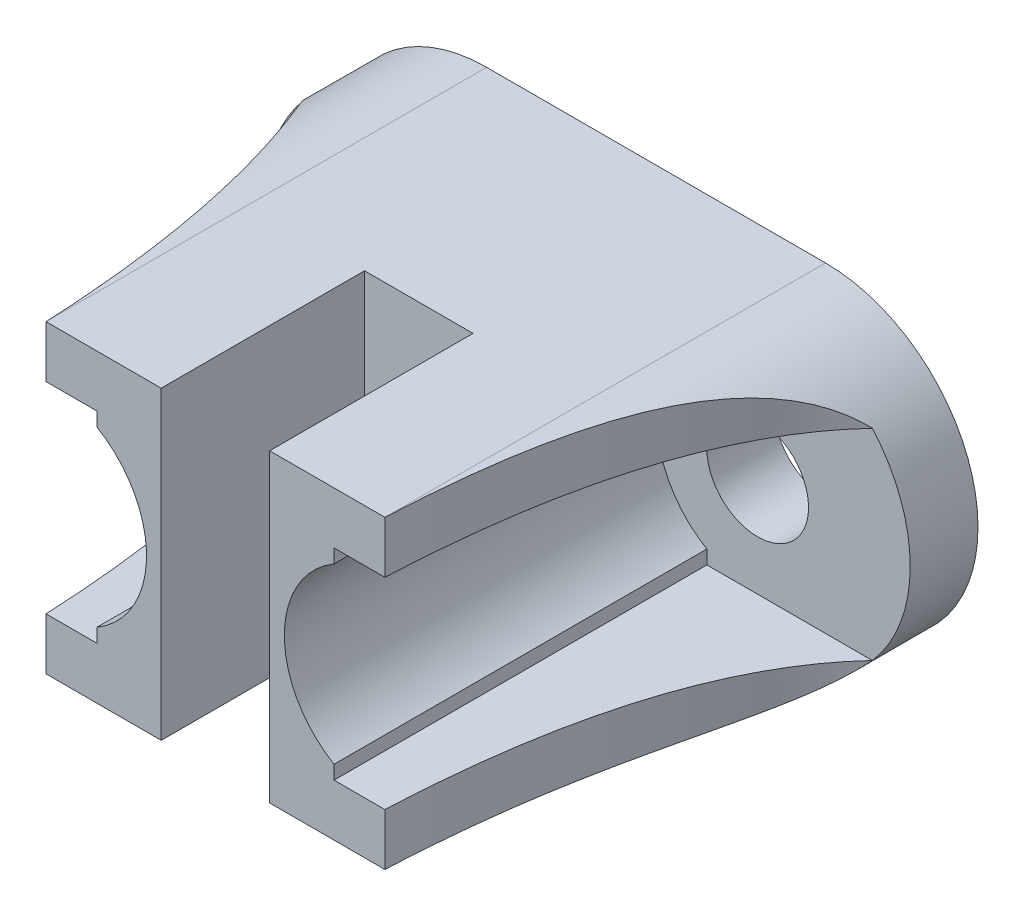
from build123d import *

# Parameters (mm, degrees)
SKETCH1_R               = 1.5
BOSS_EXTRUDE1_DEPTH     = 2
SKETCH2_W               = 7
SKETCH2_H               = 9
BOSS_EXTRUDE2_DEPTH     = 5
SKETCH2_3_W             = 1.9
SKETCH2_3_H             = 9
BOSS_EXTRUDE3_DEPTH     = 11
BOSS_EXTRUDE4_DEPTH     = 11
CUT_EXTRUDE1_DEPTH      = 17.718253497
CUT_EXTRUDE1_DEPTH_BACK = 17.718253497
SKETCH5_R               = 2.966905055
CUT_EXTRUDE2_DEPTH      = 11


with BuildPart() as part:
    # Sketch1 → Boss-Extrude1 (new body)
    with BuildSketch(Plane.XY):
        with BuildLine():
            Line((-5, 4.5), (5, 4.5))
            ThreePointArc((5, 4.5), (9.5, 0), (5, -4.5))
            Line((5, -4.5), (-5, -4.5))
            ThreePointArc((-5, -4.5), (-9.5, 0), (-5, 4.5))
        make_face()
        with Locations((-5, 0)):
            Circle(SKETCH1_R, mode=Mode.SUBTRACT)
        with Locations(Location((5, 0, 0), (0, 0, 180))):
            Circle(SKETCH1_R, mode=Mode.SUBTRACT)
    extrude(amount=BOSS_EXTRUDE1_DEPTH)

    # Sketch2 → Boss-Extrude2 (add)
    with BuildSketch(Plane.XY.offset(2)):
        Rectangle(SKETCH2_W, SKETCH2_H)
    extrude(amount=BOSS_EXTRUDE2_DEPTH)

    # Sketch2<3> → Boss-Extrude3 (add)
    with BuildSketch(Plane.XY.offset(2)):
        with Locations((-2.55, 0)):
            Rectangle(SKETCH2_3_W, SKETCH2_3_H)
        with Locations((2.55, 0)):
            Rectangle(SKETCH2_3_W, SKETCH2_3_H)
    extrude(amount=BOSS_EXTRUDE3_DEPTH)

    # Sketch3 → Boss-Extrude4 (add)
    with BuildSketch(Plane.XY.offset(2)):
        with BuildLine():
            Line((-3.5, 4.5), (-5, 4.5))
            ThreePointArc((-5, 4.5), (-6.85727317, 4.098845737), (-8.38341165, 2.966905055))
            Line((-8.38341165, 2.966905055), (-3.5, 2.966905055))
            Line((-3.5, 2.966905055), (-3.5, 4.5))
        make_face()
        with BuildLine():
            Line((-3.5, -2.966905055), (-8.38341165, -2.966905055))
            ThreePointArc((-8.38341165, -2.966905055), (-6.85727317, -4.098845737), (-5, -4.5))
            Line((-5, -4.5), (-3.5, -4.5))
            Line((-3.5, -4.5), (-3.5, -2.966905055))
        make_face()
        with BuildLine():
            Line((3.5, -4.5), (5, -4.5))
            ThreePointArc((5, -4.5), (6.85727317, -4.098845737), (8.38341165, -2.966905055))
            Line((8.38341165, -2.966905055), (3.5, -2.966905055))
            Line((3.5, -2.966905055), (3.5, -4.5))
        make_face()
        with BuildLine():
            Line((3.5, 2.966905055), (8.38341165, 2.966905055))
            ThreePointArc((8.38341165, 2.966905055), (6.85727317, 4.098845737), (5, 4.5))
            Line((5, 4.5), (3.5, 4.5))
            Line((3.5, 4.5), (3.5, 2.966905055))
        make_face()
    extrude(amount=BOSS_EXTRUDE4_DEPTH)

    # Sketch4 → Cut-Extrude1 (cut, two sides: drawn at the far end of the back side and taken through both)
    with BuildSketch(Plane(origin=(0, 0, 0), x_dir=(1, 0, 0), z_dir=(0, 1, 0)).offset(-CUT_EXTRUDE1_DEPTH_BACK)):
        with BuildLine():
            Line((-8.38341165, -2), (-12.296417953, -13.182835844))
            Line((-12.296417953, -13.182835844), (-6.078905494, -14.351094555))
            Line((-6.078905494, -14.351094555), (-5, -13))
            add(Edge.make_bspline(
                [(-8.38341165, -2), (-5.354296854, -5.236477868), (-5, -13)],
                knots=[0, 0, 0, 1, 1, 1], degree=2))
        make_face()
        with BuildLine():
            Line((5, -13), (8.38341165, -14.707512466))
            Line((8.38341165, -14.707512466), (10.514328395, -13.974875648))
            Line((10.514328395, -13.974875648), (8.38341165, -2))
            add(Edge.make_bspline(
                [(8.38341165, -2), (5.354296854, -5.236477868), (5, -13)],
                knots=[0, 0, 0, 1, 1, 1], degree=2))
        make_face()
    extrude(amount=CUT_EXTRUDE1_DEPTH + CUT_EXTRUDE1_DEPTH_BACK, mode=Mode.SUBTRACT)

    # Sketch5 → Cut-Extrude2 (cut)
    with BuildSketch(Plane.XY.offset(13)):
        with Locations((-5, 0)):
            Circle(SKETCH5_R)
        with Locations((5, 0)):
            Circle(SKETCH5_R)
    extrude(amount=-CUT_EXTRUDE2_DEPTH, mode=Mode.SUBTRACT)


solid = part.part
